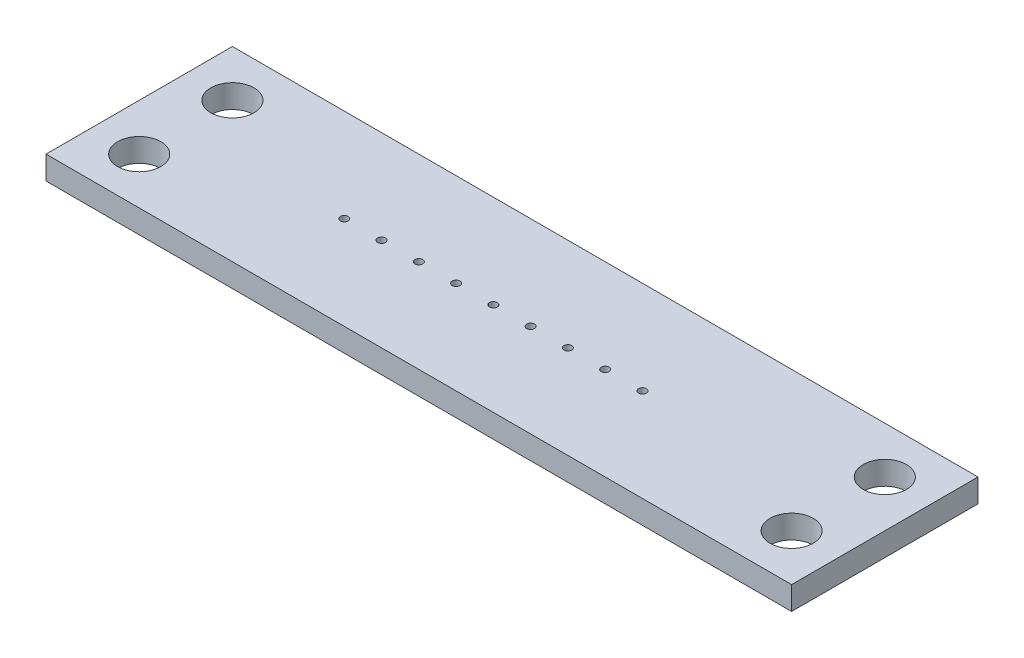
from build123d import *

# Parameters (mm, degrees)
SKETCH1_W           = 50.8
SKETCH1_H           = 12.7
BOSS_EXTRUDE1_DEPTH = 1.5875
SKETCH2_R           = 1.4732
CUT_EXTRUDE1_DEPTH  = 1.5875
SKETCH3_R           = 0.2667
CUT_EXTRUDE2_DEPTH  = 1.5875


with BuildPart() as part:
    # Sketch1 → Boss-Extrude1 (new body)
    with BuildSketch(Plane(origin=(0, 0, 0), x_dir=(1, 0, 0), z_dir=(0, 1, 0))):
        with Locations((25.4, 6.35)):
            Rectangle(SKETCH1_W, SKETCH1_H)
    extrude(amount=BOSS_EXTRUDE1_DEPTH)

    # Sketch2 → Cut-Extrude1 (cut)
    with BuildSketch(Plane(origin=(0, 1.5875, 0), x_dir=(1, 0, 0), z_dir=(0, 1, 0))):
        with Locations(Location((3.175, 9.525, 0), (0, 0, 270))):
            Circle(SKETCH2_R)
        with Locations(Location((3.175, 3.175, 0), (0, 0, 90))):
            Circle(SKETCH2_R)
        with Locations(Location((47.625, 9.525, 0), (0, 0, 90))):
            Circle(SKETCH2_R)
        with Locations(Location((47.625, 3.175, 0), (0, 0, 270))):
            Circle(SKETCH2_R)
    extrude(amount=-CUT_EXTRUDE1_DEPTH, mode=Mode.SUBTRACT)

    # Sketch3 → Cut-Extrude2 (cut)
    with BuildSketch(Plane(origin=(0, 1.5875, 0), x_dir=(1, 0, 0), z_dir=(0, 1, 0))):
        with Locations(Location((24.13, 6.35, 0), (0, 0, 270))):
            Circle(SKETCH3_R)
        with Locations(Location((21.59, 6.35, 0), (0, 0, 270))):
            Circle(SKETCH3_R)
        with Locations(Location((19.05, 6.35, 0), (0, 0, 270))):
            Circle(SKETCH3_R)
        with Locations(Location((16.51, 6.35, 0), (0, 0, 270))):
            Circle(SKETCH3_R)
        with Locations(Location((13.97, 6.35, 0), (0, 0, 270))):
            Circle(SKETCH3_R)
        with Locations(Location((26.67, 6.35, 0), (0, 0, 270))):
            Circle(SKETCH3_R)
        with Locations(Location((29.21, 6.35, 0), (0, 0, 270))):
            Circle(SKETCH3_R)
        with Locations(Location((31.75, 6.35, 0), (0, 0, 270))):
            Circle(SKETCH3_R)
        with Locations(Location((34.29, 6.35, 0), (0, 0, 270))):
            Circle(SKETCH3_R)
    extrude(amount=-CUT_EXTRUDE2_DEPTH, mode=Mode.SUBTRACT)


solid = part.part
